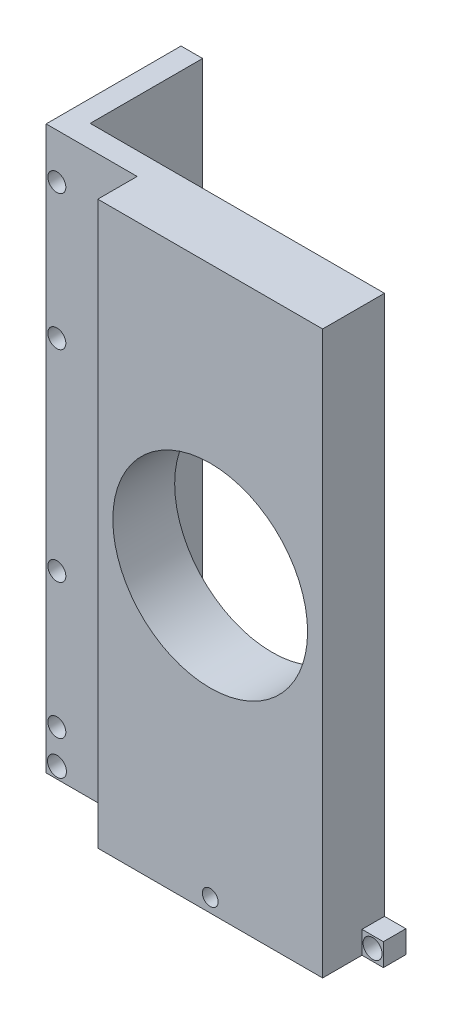
from build123d import *

# Parameters (mm, degrees)
SKETCH1_W             = 2.437632846
SKETCH1_H             = 63.5
SKETCH1_R             = 1.016
BOSS_EXTRUDE1_DEPTH   = 15.24
BOSS_EXTRUDE1_2_DEPTH = 15.24
SKETCH2_W             = 33.244360662
SKETCH2_H             = 63.5
BOSS_EXTRUDE2_DEPTH   = 2.54
SKETCH3_W             = 38.1
SKETCH3_H             = 12.7
BOSS_EXTRUDE3_DEPTH   = 2.54
SKETCH5_R             = 1.071714946
CUT_EXTRUDE2_DEPTH    = 41.040262237
SKETCH6_R             = 1.016
CUT_EXTRUDE3_DEPTH    = 41.040262237
SKETCH7_W             = 38.1
SKETCH7_H             = 2.54
SKETCH7_R             = 1.071714946
BOSS_EXTRUDE5_DEPTH   = 2.54
CUT_EXTRUDE4_DEPTH    = 41.040262237
BOSS_EXTRUDE6_START   = 4.445
SKETCH9_W             = 25.4
SKETCH9_H             = 63.5
SKETCH9_R             = 11.0000034
BOSS_EXTRUDE6_DEPTH   = 4.445
SKETCH10_W            = 35.662367154
SKETCH10_H            = 2.54
CUT_EXTRUDE5_DEPTH    = 12.7
SKETCH11_R            = 0.889
CUT_EXTRUDE7_DEPTH    = 12.7


with BuildPart() as part:
    # Sketch1 → Boss-Extrude1 (new body)
    with BuildSketch(Plane.XY):
        with Locations((-17.831183577, 0)):
            Rectangle(SKETCH1_W, SKETCH1_H)
        with Locations((-17.840996754, -26.657844962)):
            Circle(SKETCH1_R, mode=Mode.SUBTRACT)
        with Locations((-17.840996754, -11.385809707)):
            Circle(SKETCH1_R, mode=Mode.SUBTRACT)
        with Locations((-17.840996754, 11.385809707)):
            Circle(SKETCH1_R, mode=Mode.SUBTRACT)
        with Locations((-17.840996754, 26.657844962)):
            Circle(SKETCH1_R, mode=Mode.SUBTRACT)
    extrude(amount=-BOSS_EXTRUDE1_DEPTH)

    # Sketch2 → Boss-Extrude2 (add)
    with BuildSketch(Plane.XY):
        with Locations((0.009813177, 0)):
            Rectangle(SKETCH2_W, SKETCH2_H)
    extrude(amount=-BOSS_EXTRUDE2_DEPTH)

    # Sketch3 → Boss-Extrude3 (add)
    with BuildSketch(Plane.XZ.offset(31.75)):
        with Locations((0, -6.35)):
            Rectangle(SKETCH3_W, SKETCH3_H)
    extrude(amount=-BOSS_EXTRUDE3_DEPTH)

    # Sketch5 → Cut-Extrude2 (cut, through all)
    with BuildSketch(Plane.XY):
        with Locations((-17.827792249, -30.48)):
            Circle(SKETCH5_R)
        with Locations((17.827792249, -30.48)):
            Circle(SKETCH5_R)
    extrude(amount=-CUT_EXTRUDE2_DEPTH, mode=Mode.SUBTRACT)

    # Sketch7 → Boss-Extrude5 (add)
    with BuildSketch(Plane(origin=(0, 0, -12.7), x_dir=(-1, 0, 0), z_dir=(0, 0, -1))):
        with Locations((0, -30.48)):
            Rectangle(SKETCH7_W, SKETCH7_H)
        with Locations(Location((-17.827792249, -30.48, 0), (0, 0, 180))):
            Circle(SKETCH7_R, mode=Mode.SUBTRACT)
    extrude(amount=BOSS_EXTRUDE5_DEPTH)

    # Sketch8 → Cut-Extrude4 (cut, through all)
    with BuildSketch(Plane.XY):
        with BuildLine():
            ThreePointArc((-7.068009892, 1.27), (3.931993508, -9.7300034), (14.931996908, 1.27))
            Line((14.931996908, 1.27), (-7.068009892, 1.27))
        make_face()
        with BuildLine():
            Line((-7.068009892, 1.27), (14.931996908, 1.27))
            ThreePointArc((14.931996908, 1.27), (3.931993508, 12.2700034), (-7.068009892, 1.27))
        make_face()
    extrude(amount=-CUT_EXTRUDE4_DEPTH, mode=Mode.SUBTRACT)

    # Sketch9 → Boss-Extrude6 (add)
    with BuildSketch(Plane.XY.offset(BOSS_EXTRUDE6_START)):
        with Locations((3.931993508, 0)):
            Rectangle(SKETCH9_W, SKETCH9_H)
        with Locations((3.931993508, 1.27)):
            Circle(SKETCH9_R, mode=Mode.SUBTRACT)
    extrude(amount=-BOSS_EXTRUDE6_DEPTH)

    # Sketch10 → Cut-Extrude5 (cut)
    with BuildSketch(Plane(origin=(0, 0, -15.24), x_dir=(-1, 0, 0), z_dir=(0, 0, -1))):
        with Locations((-1.218816423, -30.48)):
            Rectangle(SKETCH10_W, SKETCH10_H)
    extrude(amount=-CUT_EXTRUDE5_DEPTH, mode=Mode.SUBTRACT)

    # Sketch11 → Cut-Extrude7 (cut)
    with BuildSketch(Plane.XY.offset(4.445)):
        with Locations((3.931993508, -30.217851705)):
            Circle(SKETCH11_R)
    extrude(amount=-CUT_EXTRUDE7_DEPTH, mode=Mode.SUBTRACT)


with BuildPart() as body_2:
    # Sketch1 → Boss-Extrude1 2 (new body)
    with BuildSketch(Plane.XY):
        with Locations((17.840996754, -26.657844962)):
            Circle(SKETCH1_R)
    extrude(amount=-BOSS_EXTRUDE1_2_DEPTH)

    # Sketch6 → Cut-Extrude3 (cut, through all)
    with BuildSketch(Plane.XY):
        with Locations((17.840996754, -26.657844962)):
            Circle(SKETCH6_R)
    extrude(amount=-CUT_EXTRUDE3_DEPTH, mode=Mode.SUBTRACT)


solid = part.part
